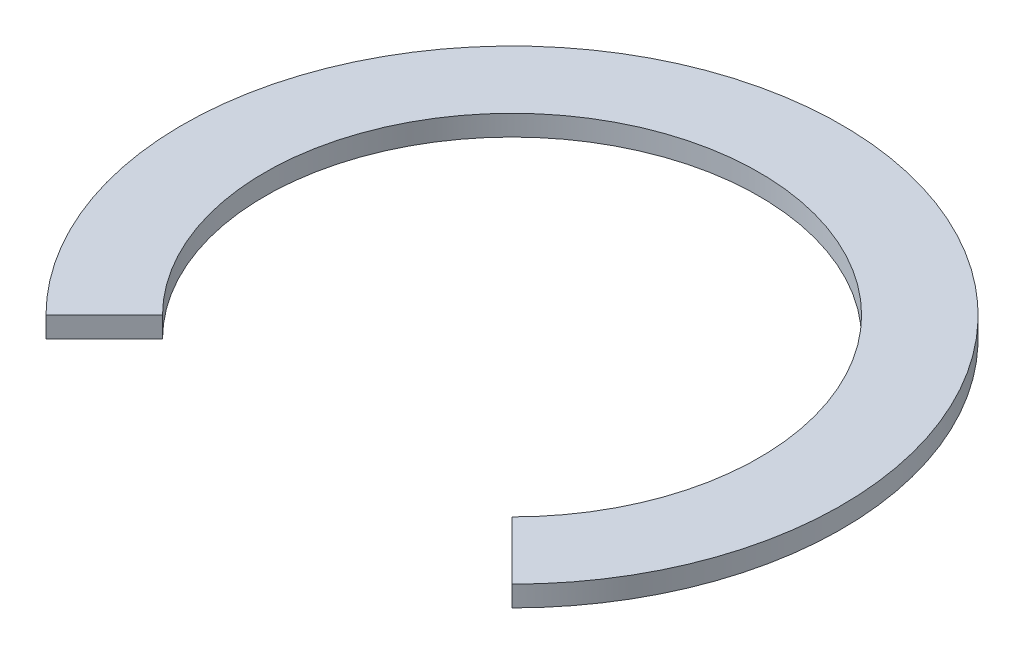
from build123d import *

# Parameters (mm, degrees)
SKETCH2_R                    = 12.7
BOSS_EXTRUDE1_DEPTH          = 0.79375
SKETCH3_R                    = 9.525
CUT_EXTRUDE1_DEPTH           = 18.978043249
SKETCH4_W                    = 22.318168974
SKETCH4_H                    = 8.357131245
CUT_REVOLVE1_ANGLE           = 45
CUT_REVOLVE1_OTHER_WAY_ANGLE = 45


with BuildPart() as part:
    # Sketch2 → Boss-Extrude1 (new body)
    with BuildSketch(Plane(origin=(0, 0, 0), x_dir=(1, 0, 0), z_dir=(0, 1, 0))):
        with Locations(Location((0, 0, 0), (0, 0, 270))):
            Circle(SKETCH2_R)
    extrude(amount=BOSS_EXTRUDE1_DEPTH)

    # Sketch3 → Cut-Extrude1 (cut, through all)
    with BuildSketch(Plane(origin=(0, 0.79375, 0), x_dir=(1, 0, 0), z_dir=(0, 1, 0))):
        with Locations(Location((0, 0, 0), (0, 0, 270))):
            Circle(SKETCH3_R)
    extrude(amount=-CUT_EXTRUDE1_DEPTH, mode=Mode.SUBTRACT)

    # Sketch4 → Cut-Revolve1 (revolve, cut)
    with BuildSketch(Plane(origin=(0, 0, 0), x_dir=(0, 0, -1), z_dir=(1, 0, 0))):
        with Locations((-11.159084487, 3.258563731)):
            Rectangle(SKETCH4_W, SKETCH4_H)
    revolve(axis=Axis((0, -0.920001892, 0), (0, 1, 0)), revolution_arc=CUT_REVOLVE1_ANGLE, mode=Mode.SUBTRACT)

    # Sketch4 → Cut-Revolve1 other way (revolve, cut)
    with BuildSketch(Plane(origin=(0, 0, 0), x_dir=(0, 0, -1), z_dir=(1, 0, 0))):
        with Locations((-11.159084487, 3.258563731)):
            Rectangle(SKETCH4_W, SKETCH4_H)
    revolve(axis=Axis((0, -0.920001892, 0), (0, -1, 0)), revolution_arc=CUT_REVOLVE1_OTHER_WAY_ANGLE, mode=Mode.SUBTRACT)


solid = part.part
